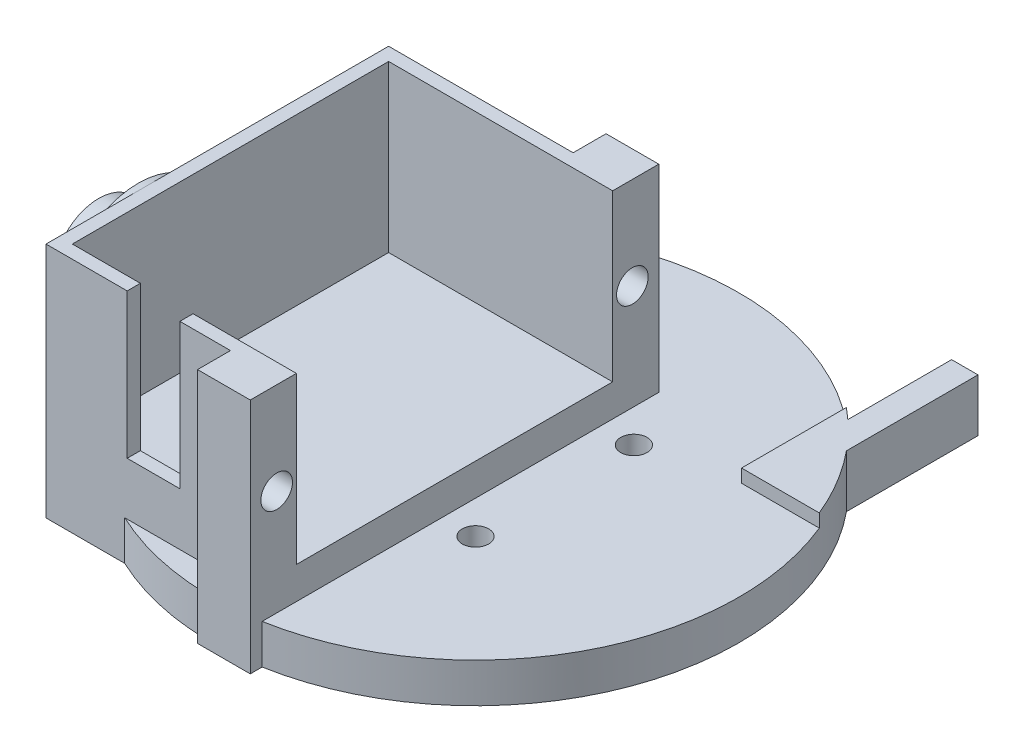
from build123d import *

# Parameters (mm, degrees)
SKETCH1_R                       = 100
BOSS_EXTRUDE1_DEPTH             = 15
BOSS_EXTRUDE2_DEPTH             = 75
BOSS_EXTRUDE2_DIRECTION_2_REACH = 144.215
SKETCH3_W                       = 85
SKETCH3_H                       = 120
CUT_EXTRUDE1_DEPTH              = 62.8
SKETCH4_W                       = 20
SKETCH4_H                       = 55
CUT_EXTRUDE2_DEPTH              = 5
SKETCH5_R                       = 30
BOSS_EXTRUDE3_DEPTH             = 2.5
SKETCH6_R                       = 17.5
BOSS_EXTRUDE4_DEPTH             = 15
BOSS_EXTRUDE5_DEPTH             = 5
BOSS_EXTRUDE5_DIRECTION_2_REACH = 163.942
SKETCH8_R                       = 6
CUT_EXTRUDE3_DEPTH              = 20
SKETCH11_R                      = 5
CUT_EXTRUDE4_DEPTH              = 15


with BuildPart() as part:
    # Sketch1 → Boss-Extrude1 (new body)
    with BuildSketch(Plane(origin=(0, 0, 0), x_dir=(1, 0, 0), z_dir=(0, 1, 0))):
        with Locations(Location((0, 0, 0), (0, 0, 270))):
            Circle(SKETCH1_R)
    extrude(amount=BOSS_EXTRUDE1_DEPTH)

    # Sketch2 → Boss-Extrude2 (add)
    with BuildSketch(Plane(origin=(0, 15, 0), x_dir=(1, 0, 0), z_dir=(0, 1, 0))):
        Polygon((-2.5, 52.043156662), (-2.5, 39.543156662), (-72.5, 39.543156662), (-72.5, -90.456843338), (-2.5, -90.456843338), (-2.5, -102.956843338), (17.5, -102.956843338), (17.5, 52.043156662), align=None)
    extrude(amount=BOSS_EXTRUDE2_DEPTH)

    # Boss-Extrude2 direction 2: up to this face of the body (flat: up to its plane)
    boss_extrude2_direction_2_end = Plane(part.part.faces().sort_by_distance((0, 0, 0))[0])
    # Sketch2 → Boss-Extrude2 direction 2 (add, up to the picked face)
    with BuildSketch(Plane(origin=(0, 15, 0), x_dir=(1, 0, 0), z_dir=(0, 1, 0)), mode=Mode.PRIVATE) as boss_extrude2_direction_2_sk1:
        Polygon((-2.5, 52.043156662), (-2.5, 39.543156662), (-72.5, 39.543156662), (-72.5, -90.456843338), (-2.5, -90.456843338), (-2.5, -102.956843338), (17.5, -102.956843338), (17.5, 52.043156662), align=None)
    boss_extrude2_direction_2_tool1 = split(extrude(boss_extrude2_direction_2_sk1.sketch, amount=-BOSS_EXTRUDE2_DIRECTION_2_REACH, mode=Mode.PRIVATE), bisect_by=boss_extrude2_direction_2_end, keep=Keep.BOTH, mode=Mode.PRIVATE)
    add(boss_extrude2_direction_2_tool1.solids().sort_by(Axis((-26.065574, 15, 25.456843), (0, -1, 0)))[0])

    # Sketch3 → Cut-Extrude1 (cut)
    with BuildSketch(Plane(origin=(0, 90, 0), x_dir=(1, 0, 0), z_dir=(0, 1, 0))):
        with Locations((-25, -25.456843338)):
            Rectangle(SKETCH3_W, SKETCH3_H)
    extrude(amount=-CUT_EXTRUDE1_DEPTH, mode=Mode.SUBTRACT)

    # Sketch4 → Cut-Extrude2 (cut)
    with BuildSketch(Plane.XY.offset(90.456843338)):
        with Locations((-31.7, 62.5)):
            Rectangle(SKETCH4_W, SKETCH4_H)
    extrude(amount=-CUT_EXTRUDE2_DEPTH, mode=Mode.SUBTRACT)

    # Sketch5 → Boss-Extrude3 (add)
    with BuildSketch(Plane.ZY.offset(72.5)):
        with Locations(Location((52.956843338, 60, 0), (0, 0, 90))):
            Circle(SKETCH5_R)
    extrude(amount=BOSS_EXTRUDE3_DEPTH)

    # Sketch6 → Boss-Extrude4 (add)
    with BuildSketch(Plane.ZY.offset(75)):
        with Locations((52.956843338, 60)):
            Circle(SKETCH6_R)
    extrude(amount=BOSS_EXTRUDE4_DEPTH)

    # Sketch7 → Boss-Extrude5 (add)
    with BuildSketch(Plane(origin=(0, 15, 0), x_dir=(1, 0, 0), z_dir=(0, 1, 0))):
        with BuildLine():
            Line((63.042469592, 37.893156662), (92.542469592, 37.893156662))
            ThreePointArc((92.542469592, 37.893156662), (85.873522386, 51.24195696), (77.292469592, 63.449776551))
            Line((77.292469592, 63.449776551), (77.292469592, 113.371099331))
            Line((77.292469592, 113.371099331), (67.292469592, 113.371099331))
            Line((67.292469592, 113.371099331), (67.292469592, 73.971099331))
            ThreePointArc((67.292469592, 73.971099331), (65.19307414, 75.827851639), (63.042469592, 77.625041242))
            Line((63.042469592, 77.625041242), (63.042469592, 37.893156662))
        make_face()
    extrude(amount=BOSS_EXTRUDE5_DEPTH)

    # Boss-Extrude5 direction 2: up to this face of the body (flat: up to its plane)
    boss_extrude5_direction_2_end = Plane(part.part.faces().sort_by_distance((-0.54005377, 0, 0.955561691))[0])
    # Sketch7 → Boss-Extrude5 direction 2 (add, up to the picked face)
    with BuildSketch(Plane(origin=(0, 15, 0), x_dir=(1, 0, 0), z_dir=(0, 1, 0)), mode=Mode.PRIVATE) as boss_extrude5_direction_2_sk1:
        with BuildLine():
            Line((63.042469592, 37.893156662), (92.542469592, 37.893156662))
            ThreePointArc((92.542469592, 37.893156662), (85.873522386, 51.24195696), (77.292469592, 63.449776551))
            Line((77.292469592, 63.449776551), (77.292469592, 113.371099331))
            Line((77.292469592, 113.371099331), (67.292469592, 113.371099331))
            Line((67.292469592, 113.371099331), (67.292469592, 73.971099331))
            ThreePointArc((67.292469592, 73.971099331), (65.19307414, 75.827851639), (63.042469592, 77.625041242))
            Line((63.042469592, 77.625041242), (63.042469592, 37.893156662))
        make_face()
    boss_extrude5_direction_2_tool1 = split(extrude(boss_extrude5_direction_2_sk1.sketch, amount=-BOSS_EXTRUDE5_DIRECTION_2_REACH, mode=Mode.PRIVATE), bisect_by=boss_extrude5_direction_2_end, keep=Keep.BOTH, mode=Mode.PRIVATE)
    add(boss_extrude5_direction_2_tool1.solids().sort_by(Axis((73.261773, 15, -67.454705), (0, -1, 0)))[0])

    # Sketch8 → Cut-Extrude3 (cut)
    with BuildSketch(Plane(origin=(17.5, 0, 0), x_dir=(0, 0, -1), z_dir=(1, 0, 0))):
        with Locations((-92.931843338, 55)):
            Circle(SKETCH8_R)
        with Locations(Location((42.018156662, 55, 0), (0, 0, 245.63802206))):
            Circle(SKETCH8_R)
    extrude(amount=-CUT_EXTRUDE3_DEPTH, mode=Mode.SUBTRACT)

    # Sketch11 → Cut-Extrude4 (cut)
    with BuildSketch(Plane.XZ):
        with Locations(Location((-30.0520382, 30.0520382, 0), (0, 0, 270))):
            Circle(SKETCH11_R)
        with Locations(Location((30.0520382, 30.0520382, 0), (0, 0, 270))):
            Circle(SKETCH11_R)
        with Locations(Location((30.0520382, -30.0520382, 0), (0, 0, 270))):
            Circle(SKETCH11_R)
        with Locations(Location((-30.0520382, -30.0520382, 0), (0, 0, 270))):
            Circle(SKETCH11_R)
    extrude(amount=-CUT_EXTRUDE4_DEPTH, mode=Mode.SUBTRACT)


solid = part.part
